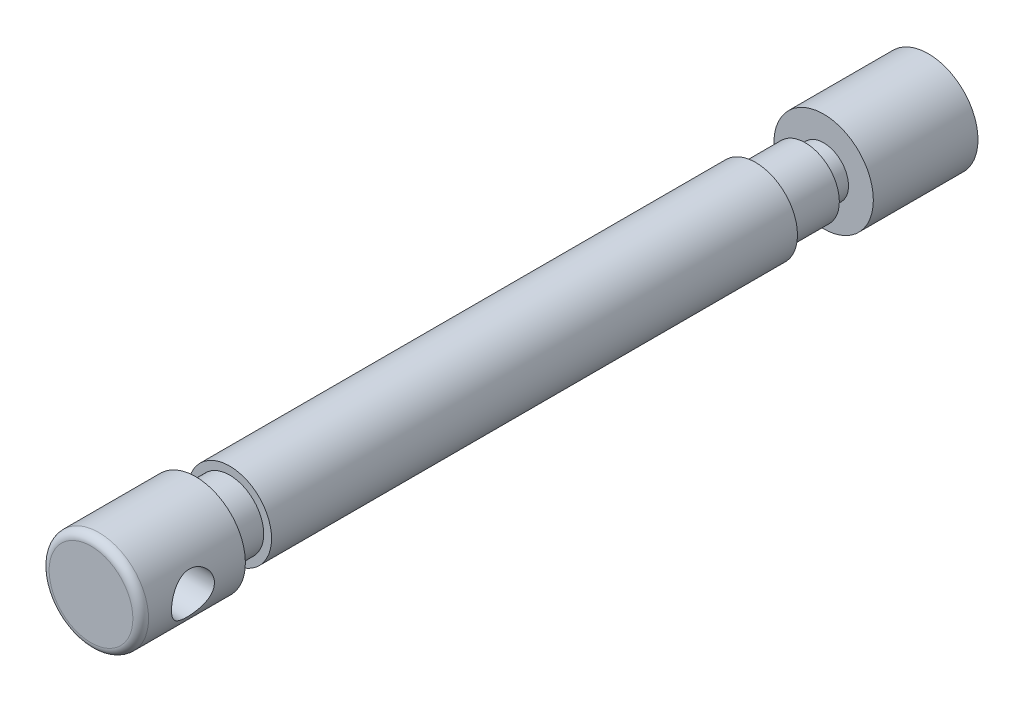
from build123d import *

# Parameters (mm, degrees)
SKETCH1_R               = 9.5
BOSS_EXTRUDE1_DEPTH     = 20
SKETCH2_R               = 4.75
BOSS_EXTRUDE2_DEPTH     = 3.5
SKETCH3_R               = 6.5
BOSS_EXTRUDE3_DEPTH     = 9.5
SKETCH4_R               = 8
BOSS_EXTRUDE4_DEPTH     = 100.5
SKETCH5_R               = 6.5
BOSS_EXTRUDE5_DEPTH     = 6.5
SKETCH6_R               = 9.5
BOSS_EXTRUDE6_DEPTH     = 20
CUT_EXTRUDE1_DEPTH      = 161.563071719
CUT_EXTRUDE1_DEPTH_BACK = 161.563071719
SKETCH7_R               = 4.1
FILLET1_R               = 1.5


with BuildPart() as part:
    # Sketch1 → Boss-Extrude1 (new body)
    with BuildSketch(Plane.XY):
        Circle(SKETCH1_R)
    extrude(amount=BOSS_EXTRUDE1_DEPTH)

    # Sketch2 → Boss-Extrude2 (add)
    with BuildSketch(Plane.XY.offset(20)):
        Circle(SKETCH2_R)
    extrude(amount=BOSS_EXTRUDE2_DEPTH)

    # Sketch3 → Boss-Extrude3 (add)
    with BuildSketch(Plane.XY.offset(23.5)):
        Circle(SKETCH3_R)
    extrude(amount=BOSS_EXTRUDE3_DEPTH)

    # Sketch4 → Boss-Extrude4 (add)
    with BuildSketch(Plane.XY.offset(33)):
        Circle(SKETCH4_R)
    extrude(amount=BOSS_EXTRUDE4_DEPTH)

    # Sketch5 → Boss-Extrude5 (add)
    with BuildSketch(Plane.XY.offset(133.5)):
        Circle(SKETCH5_R)
    extrude(amount=BOSS_EXTRUDE5_DEPTH)

    # Sketch6 → Boss-Extrude6 (add)
    with BuildSketch(Plane.XY.offset(140)):
        Circle(SKETCH6_R)
    extrude(amount=BOSS_EXTRUDE6_DEPTH)

    # Sketch7 → Cut-Extrude1 (cut, two sides: drawn at the far end of the back side and taken through both)
    with BuildSketch(Plane(origin=(0, 0, 0), x_dir=(0, 0, -1), z_dir=(1, 0, 0)).offset(-CUT_EXTRUDE1_DEPTH_BACK)):
        with Locations((-150, -0.5)):
            Circle(SKETCH7_R)
    extrude(amount=CUT_EXTRUDE1_DEPTH + CUT_EXTRUDE1_DEPTH_BACK, mode=Mode.SUBTRACT)

    # Fillet1
    fillet1_edges = [part.edges().sort_by_distance(p)[0] for p in [
        (-9.5, 0, 160),
    ]]
    fillet(fillet1_edges, radius=FILLET1_R)


solid = part.part
